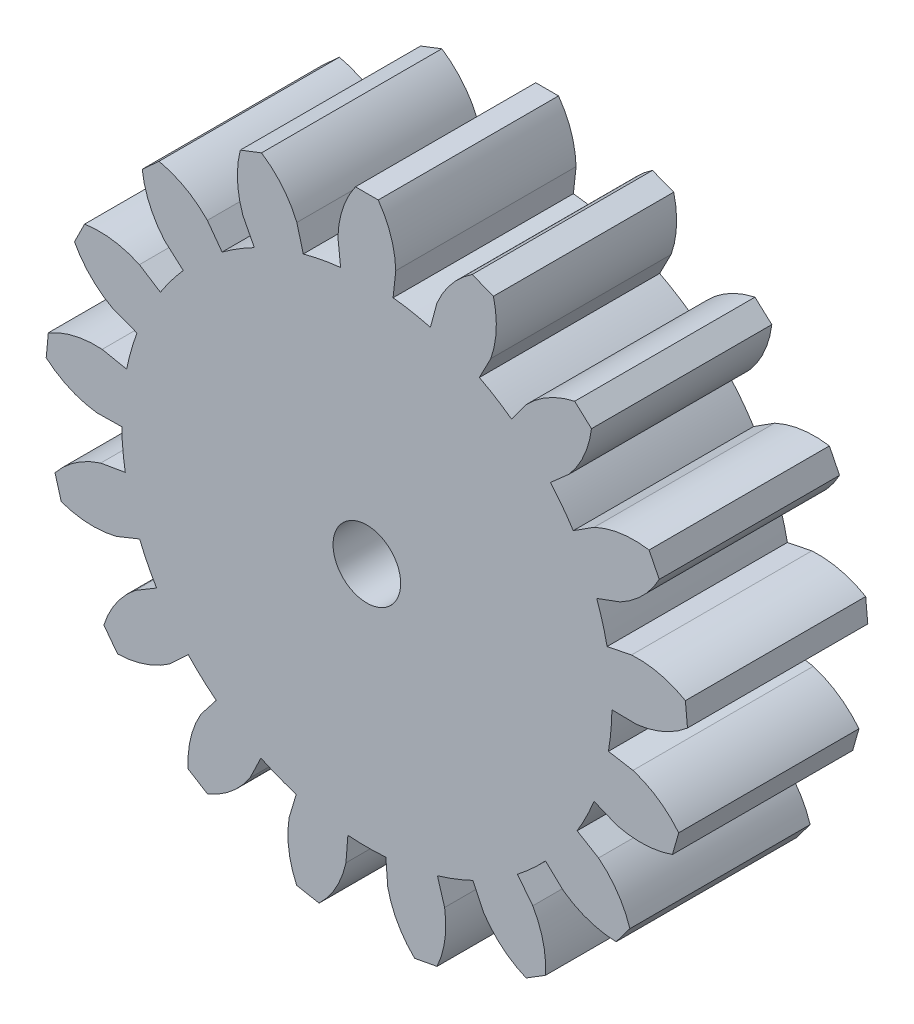
from build123d import *

# Parameters (mm, degrees)
SKETCH2_R           = 10.875
BOSS_EXTRUDE1_DEPTH = 8
BOSS_EXTRUDE2_DEPTH = 8
CIRPATTERN1_COUNT   = 17
SKETCH4_R           = 1.5
CUT_EXTRUDE1_DEPTH  = 8


with BuildPart() as part:
    # Sketch2 → Boss-Extrude1 (new body)
    with BuildSketch(Plane.XY):
        Circle(SKETCH2_R)
    extrude(amount=BOSS_EXTRUDE1_DEPTH)

    # Sketch3 → Boss-Extrude2 (add)
    with BuildSketch(Plane.XY):
        with BuildLine():
            Line((0, 0), (1.283129739, 11.912092137))
            ThreePointArc((1.283129739, 11.912092137), (1.067981869, 13.134543649), (0.505520156, 14.241030488))
            Line((0.505520156, 14.241030488), (-0.505520156, 14.241030488))
            ThreePointArc((-0.505520156, 14.241030488), (-1.067981869, 13.134543649), (-1.283129739, 11.912092137))
            Line((-1.283129739, 11.912092137), (0, 0))
        make_face()
    boss_extrude2 = extrude(amount=BOSS_EXTRUDE2_DEPTH)

    # CirPattern1: Boss-Extrude2 ×17 about axis
    cirpattern1_axis = Axis((0, 0, 0), (0, 0, 1))
    for i in range(1, CIRPATTERN1_COUNT):
        add(boss_extrude2.rotate(cirpattern1_axis, i * 360 / CIRPATTERN1_COUNT))

    # Sketch4 → Cut-Extrude1 (cut)
    with BuildSketch(Plane.XY.offset(8)):
        Circle(SKETCH4_R)
    extrude(amount=-CUT_EXTRUDE1_DEPTH, mode=Mode.SUBTRACT)


solid = part.part
